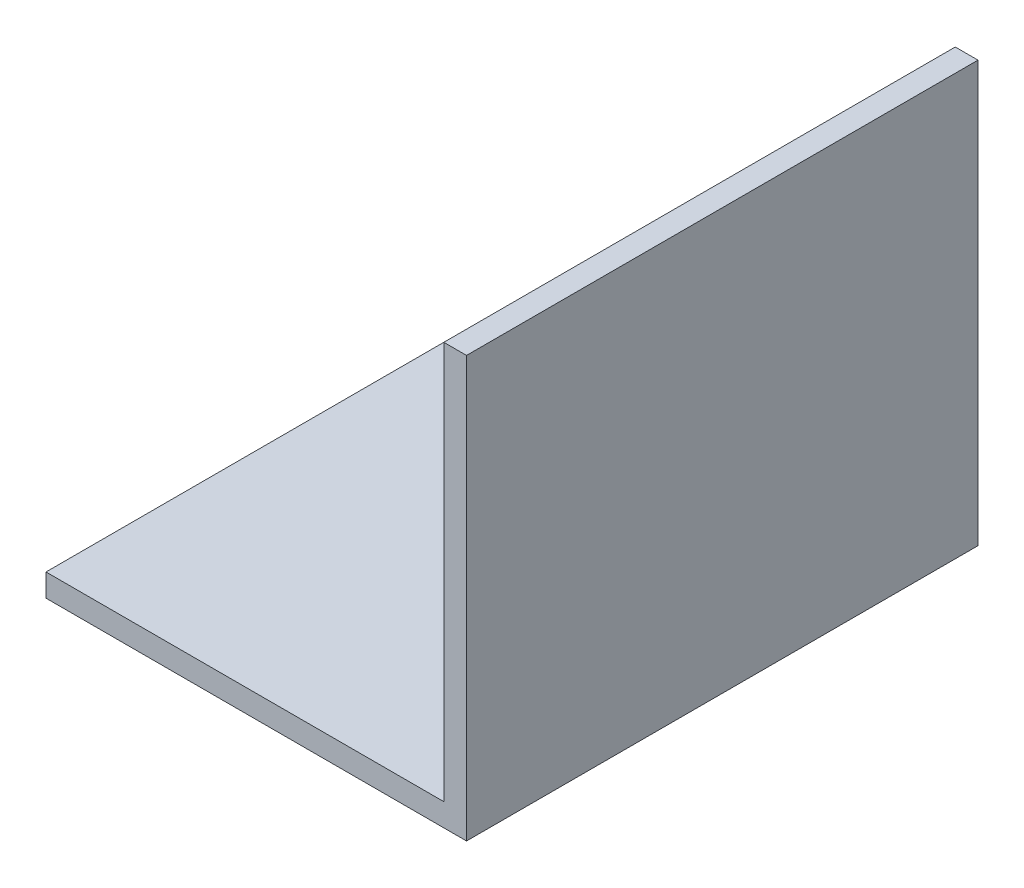
from build123d import *

# Parameters (mm, degrees)
BOSS_EXTRUDE1_DEPTH = 45


with BuildPart() as part:
    # Sketch1 → Boss-Extrude1 (new body)
    with BuildSketch(Plane.XY):
        Polygon((0, 37), (0, 0), (-37, 0), (-37, 2), (-2, 2), (-2, 37), align=None)
    extrude(amount=BOSS_EXTRUDE1_DEPTH)


solid = part.part
